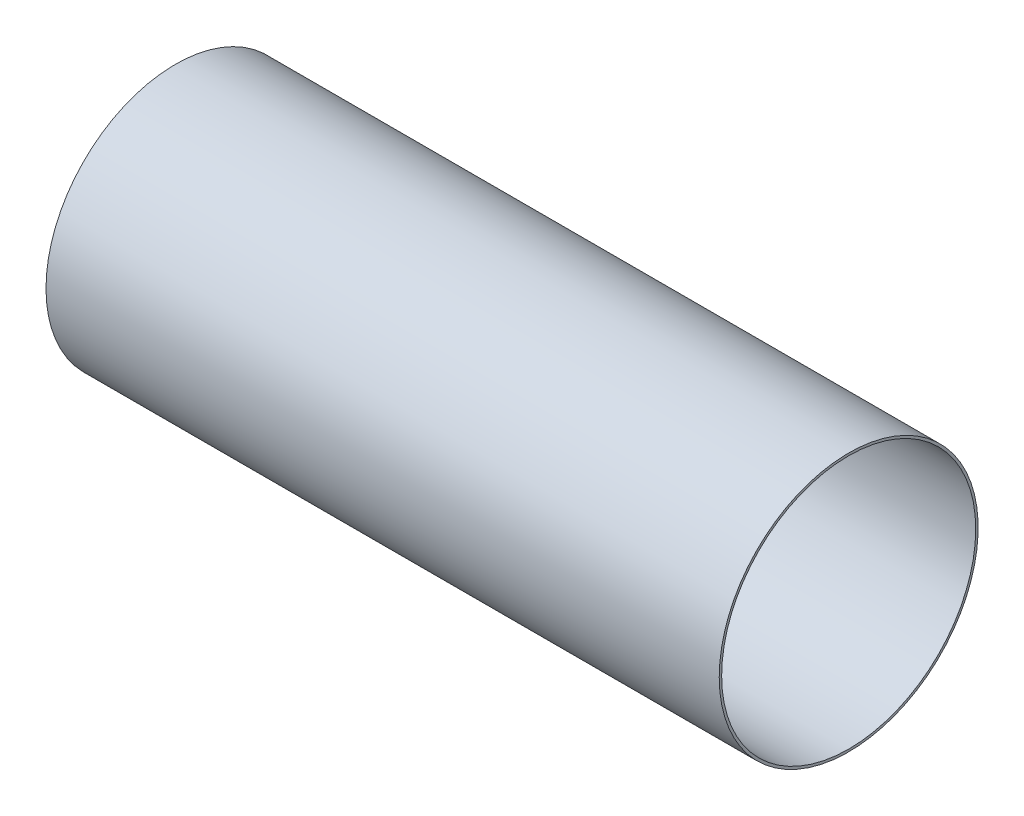
from build123d import *

# Parameters (mm, degrees)
SKETCH_2_R      = 160
SKETCH_2_R_2    = 157
EXTRUDE_1_DEPTH = 832


with BuildPart() as part:
    # 草图2 → 凸台-拉伸1 (new body)
    with BuildSketch(Plane(origin=(0, 0, 0), x_dir=(0, 0, -1), z_dir=(1, 0, 0))):
        with Locations(Location((0, 0, 0), (0, 0, 180))):
            Circle(SKETCH_2_R)
        with Locations(Location((0, 0, 0), (0, 0, 180))):
            Circle(SKETCH_2_R_2, mode=Mode.SUBTRACT)
    extrude(amount=EXTRUDE_1_DEPTH)


solid = part.part
